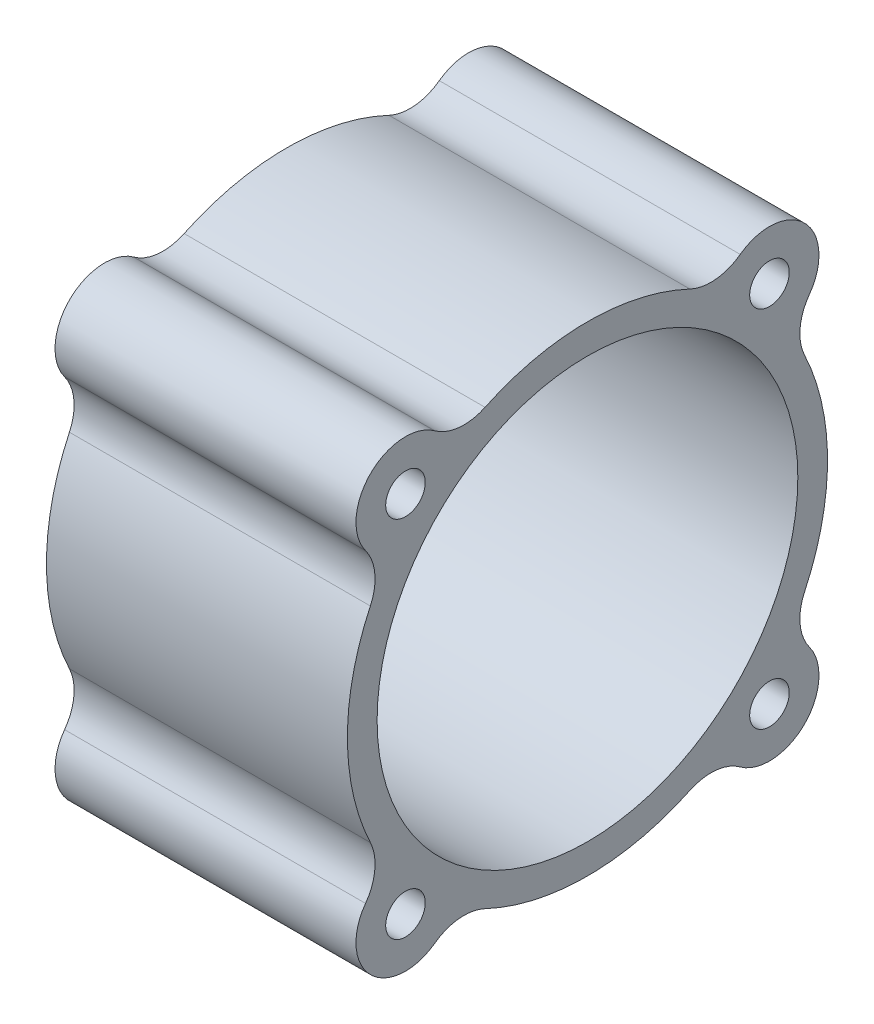
from build123d import *

# Parameters (mm, degrees)
SKETCH_1_R      = 21.25
SKETCH_1_R_2    = 2
EXTRUDE_1_DEPTH = 15.2


with BuildPart() as part:
    # 草图1 → 凸台-拉伸1 (new, symmetric)
    with BuildSketch(Plane(origin=(0, 0, 0), x_dir=(0, 0, -1), z_dir=(1, 0, 0))):
        with BuildLine():
            ThreePointArc((-15.431825442, 22.419634577), (-21.920310245, 21.920310245), (-22.419634577, 15.431825442))
            ThreePointArc((-22.419634577, 15.431825442), (-21.477282941, 12.955720303), (-21.932357291, 10.345733597))
            ThreePointArc((-21.932357291, 10.345733597), (-24.25, 0), (-21.932357291, -10.345733597))
            ThreePointArc((-21.932357291, -10.345733597), (-21.477282941, -12.955720303), (-22.419634577, -15.431825442))
            ThreePointArc((-22.419634577, -15.431825442), (-21.920310245, -21.920310245), (-15.431825442, -22.419634577))
            ThreePointArc((-15.431825442, -22.419634577), (-12.955720303, -21.477282941), (-10.345733597, -21.932357291))
            ThreePointArc((-10.345733597, -21.932357291), (0, -24.25), (10.345733597, -21.932357291))
            ThreePointArc((10.345733597, -21.932357291), (12.955720303, -21.477282941), (15.431825442, -22.419634577))
            ThreePointArc((15.431825442, -22.419634577), (21.920310245, -21.920310245), (22.419634577, -15.431825442))
            ThreePointArc((22.419634577, -15.431825442), (21.477282941, -12.955720303), (21.932357291, -10.345733597))
            ThreePointArc((21.932357291, -10.345733597), (24.25, 0), (21.932357291, 10.345733597))
            ThreePointArc((21.932357291, 10.345733597), (21.477282941, 12.955720303), (22.419634577, 15.431825442))
            ThreePointArc((22.419634577, 15.431825442), (21.920310245, 21.920310245), (15.431825442, 22.419634577))
            ThreePointArc((15.431825442, 22.419634577), (12.955720303, 21.477282941), (10.345733597, 21.932357291))
            ThreePointArc((10.345733597, 21.932357291), (0, 24.25), (-10.345733597, 21.932357291))
            ThreePointArc((-10.345733597, 21.932357291), (-12.955720303, 21.477282941), (-15.431825442, 22.419634577))
        make_face()
        with Locations(Location((0, 0, 0), (0, 0, 180))):
            Circle(SKETCH_1_R, mode=Mode.SUBTRACT)
        with Locations(Location((-18.384776339, 18.384776339, 0), (0, 0, 180))):
            Circle(SKETCH_1_R_2, mode=Mode.SUBTRACT)
        with Locations(Location((18.384776339, 18.384776339, 0), (0, 0, 180))):
            Circle(SKETCH_1_R_2, mode=Mode.SUBTRACT)
        with Locations(Location((18.384776339, -18.384776339, 0), (0, 0, 180))):
            Circle(SKETCH_1_R_2, mode=Mode.SUBTRACT)
        with Locations(Location((-18.384776339, -18.384776339, 0), (0, 0, 180))):
            Circle(SKETCH_1_R_2, mode=Mode.SUBTRACT)
    extrude(amount=EXTRUDE_1_DEPTH, both=True)


solid = part.part
